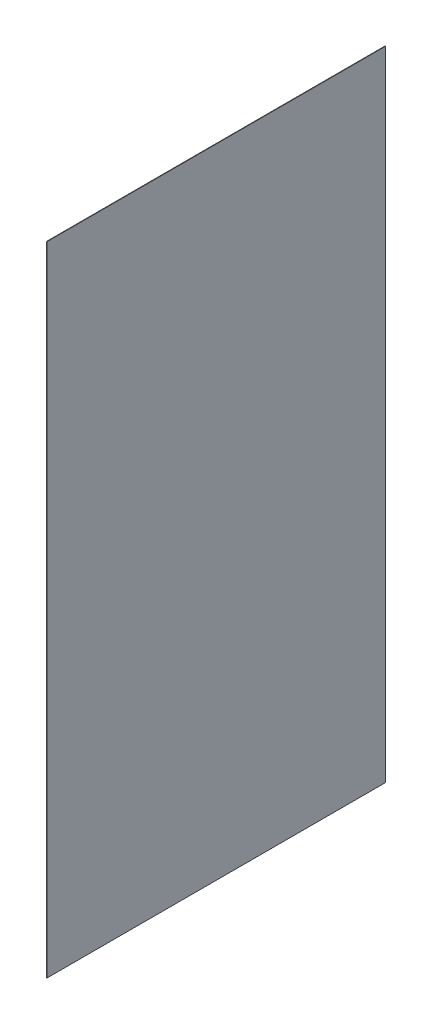
from build123d import *

# Parameters (mm, degrees)
SKETCH1_W                = 1
SKETCH1_H                = 1429.5
STORE_IC_YAN_SAG_1_DEPTH = 758.5


with BuildPart() as part:
    # Sketch1 → STORE_ic_yan_sag_1 (new body)
    with BuildSketch(Plane.XY):
        with Locations((1338, 896.25)):
            Rectangle(SKETCH1_W, SKETCH1_H)
    extrude(amount=-STORE_IC_YAN_SAG_1_DEPTH)


solid = part.part
